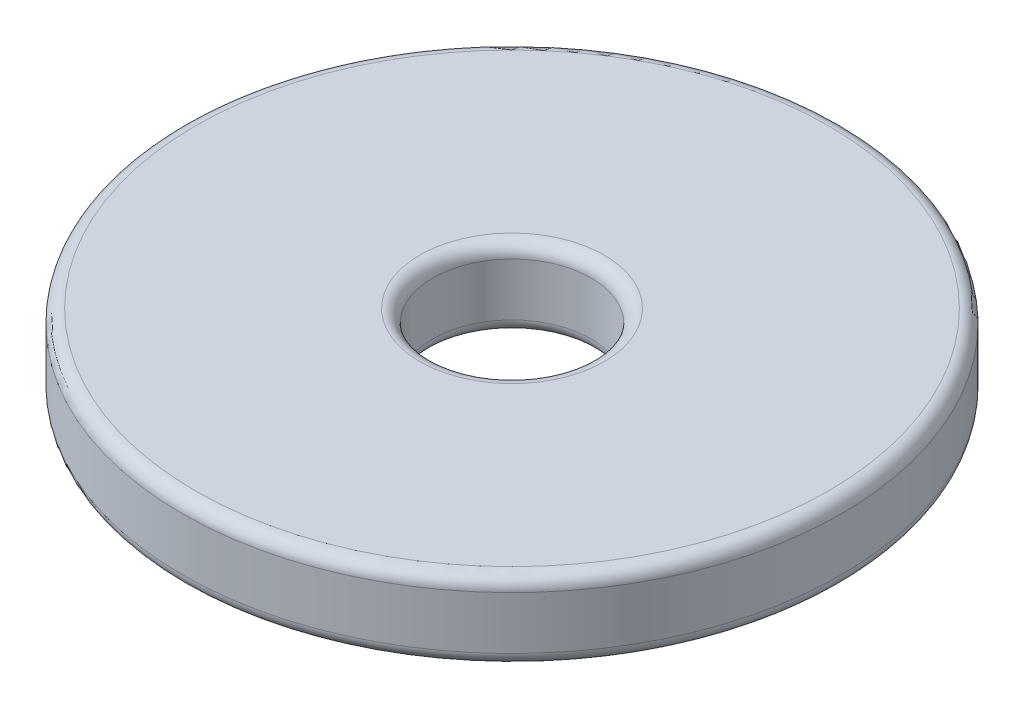
from build123d import *

# Parameters (mm, degrees)
CROQUIS1_R              = 12.5
CROQUIS1_R_2            = 3
SALIENTE_EXTRUIR1_DEPTH = 3
REDONDEO1_R             = 0.5


with BuildPart() as part:
    # Croquis1 → Saliente-Extruir1 (new body)
    with BuildSketch(Plane(origin=(0, 0, 0), x_dir=(1, 0, 0), z_dir=(0, 1, 0))):
        with Locations(Location((0, 0, 0), (0, 0, 270))):
            Circle(CROQUIS1_R)
        with Locations(Location((0, 0, 0), (0, 0, 270))):
            Circle(CROQUIS1_R_2, mode=Mode.SUBTRACT)
    extrude(amount=SALIENTE_EXTRUIR1_DEPTH)

    # Redondeo1
    redondeo1_edges = [part.edges().sort_by_distance(p)[0] for p in [
        (0, 0, -12.5),
        (0, 3, -12.5),
        (0, 0, -3),
        (0, 3, -3),
    ]]
    fillet(redondeo1_edges, radius=REDONDEO1_R)


solid = part.part
